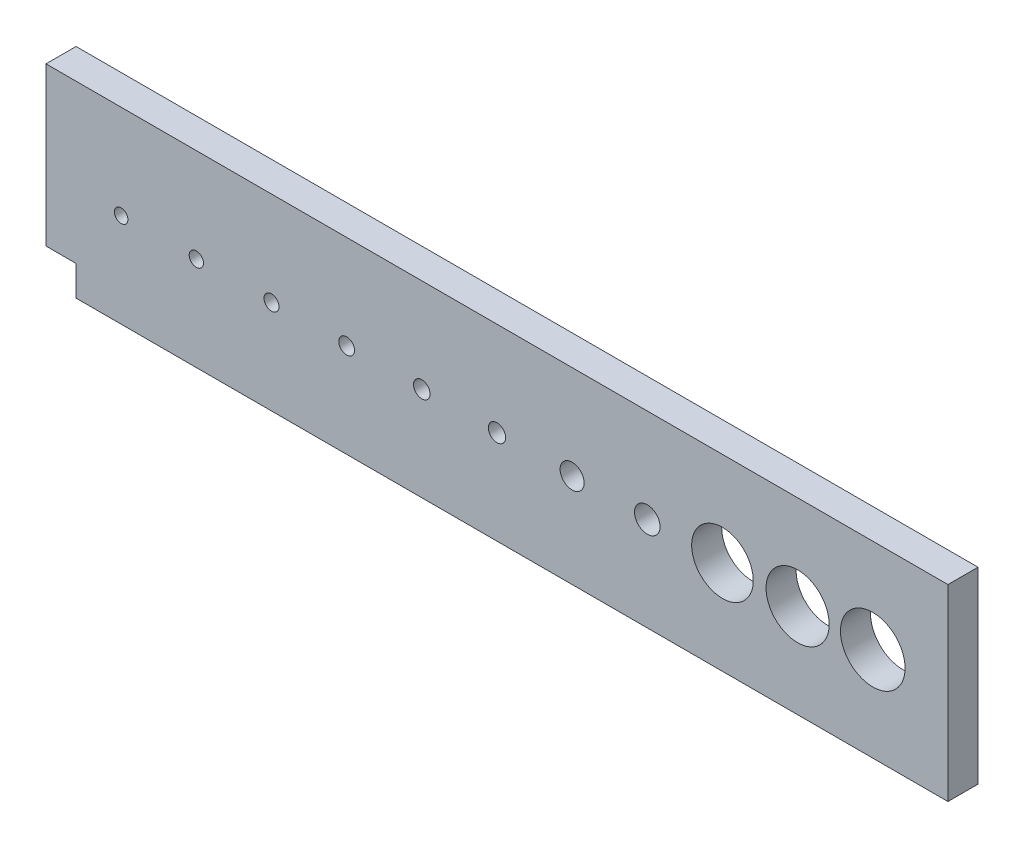
from build123d import *

# Parameters (mm, degrees)
SKETCH1_W               = 120
SKETCH1_H               = 25
COUPON_120X25_DEPTH     = 4
DIAMETER_1P8_START      = -0.1
SKETCH2_R               = 0.9
DIAMETER_1P8_DEPTH      = 4.2
DIAMETER_1P9_START      = -0.1
SKETCH3_R               = 0.95
DIAMETER_1P9_DEPTH      = 4.2
DIAMETER_2_START        = -0.1
SKETCH4_R               = 1
DIAMETER_2_DEPTH        = 4.2
DIAMETER_2P1_START      = -0.1
SKETCH5_R               = 1.05
DIAMETER_2P1_DEPTH      = 4.2
DIAMETER_2P2_START      = -0.1
SKETCH6_R               = 1.1
DIAMETER_2P2_DEPTH      = 4.2
DIAMETER_2P3_START      = -0.1
SKETCH7_R               = 1.15
DIAMETER_2P3_DEPTH      = 4.2
DIAMETER_3P2_START      = -0.1
SKETCH8_R               = 1.6
DIAMETER_3P2_DEPTH      = 4.2
DIAMETER_3P4_START      = -0.1
SKETCH9_R               = 1.7
DIAMETER_3P4_DEPTH      = 4.2
DIAMETER_8P2_START      = -0.1
SKETCH10_R              = 4.1
DIAMETER_8P2_DEPTH      = 4.2
DIAMETER_8P4_START      = -0.1
SKETCH11_R              = 4.2
DIAMETER_8P4_DEPTH      = 4.2
DIAMETER_8P6_START      = -0.1
SKETCH12_R              = 4.3
DIAMETER_8P6_DEPTH      = 4.2
ORIENTATION_NOTCH_START = -0.1
SKETCH13_W              = 4
SKETCH13_H              = 4
ORIENTATION_NOTCH_DEPTH = 4.2


with BuildPart() as part:
    # Sketch1 → Coupon_120x25 (new body)
    with BuildSketch(Plane.XY):
        Rectangle(SKETCH1_W, SKETCH1_H)
    extrude(amount=COUPON_120X25_DEPTH)

    # Sketch2 → Diameter_1p8 (cut)
    with BuildSketch(Plane.XY.offset(DIAMETER_1P8_START)):
        with Locations(Location((-50, 0, 0), (0, 0, 180))):
            Circle(SKETCH2_R)
    extrude(amount=DIAMETER_1P8_DEPTH, mode=Mode.SUBTRACT)

    # Sketch3 → Diameter_1p9 (cut)
    with BuildSketch(Plane.XY.offset(DIAMETER_1P9_START)):
        with Locations(Location((-40, 0, 0), (0, 0, 180))):
            Circle(SKETCH3_R)
    extrude(amount=DIAMETER_1P9_DEPTH, mode=Mode.SUBTRACT)

    # Sketch4 → Diameter_2 (cut)
    with BuildSketch(Plane.XY.offset(DIAMETER_2_START)):
        with Locations(Location((-30, 0, 0), (0, 0, 180))):
            Circle(SKETCH4_R)
    extrude(amount=DIAMETER_2_DEPTH, mode=Mode.SUBTRACT)

    # Sketch5 → Diameter_2p1 (cut)
    with BuildSketch(Plane.XY.offset(DIAMETER_2P1_START)):
        with Locations(Location((-20, 0, 0), (0, 0, 180))):
            Circle(SKETCH5_R)
    extrude(amount=DIAMETER_2P1_DEPTH, mode=Mode.SUBTRACT)

    # Sketch6 → Diameter_2p2 (cut)
    with BuildSketch(Plane.XY.offset(DIAMETER_2P2_START)):
        with Locations(Location((-10, 0, 0), (0, 0, 180))):
            Circle(SKETCH6_R)
    extrude(amount=DIAMETER_2P2_DEPTH, mode=Mode.SUBTRACT)

    # Sketch7 → Diameter_2p3 (cut)
    with BuildSketch(Plane.XY.offset(DIAMETER_2P3_START)):
        with Locations(Location((0, 0, 0), (0, 0, 180))):
            Circle(SKETCH7_R)
    extrude(amount=DIAMETER_2P3_DEPTH, mode=Mode.SUBTRACT)

    # Sketch8 → Diameter_3p2 (cut)
    with BuildSketch(Plane.XY.offset(DIAMETER_3P2_START)):
        with Locations(Location((10, 0, 0), (0, 0, 180))):
            Circle(SKETCH8_R)
    extrude(amount=DIAMETER_3P2_DEPTH, mode=Mode.SUBTRACT)

    # Sketch9 → Diameter_3p4 (cut)
    with BuildSketch(Plane.XY.offset(DIAMETER_3P4_START)):
        with Locations(Location((20, 0, 0), (0, 0, 180))):
            Circle(SKETCH9_R)
    extrude(amount=DIAMETER_3P4_DEPTH, mode=Mode.SUBTRACT)

    # Sketch10 → Diameter_8p2 (cut)
    with BuildSketch(Plane.XY.offset(DIAMETER_8P2_START)):
        with Locations(Location((30, 0, 0), (0, 0, 180))):
            Circle(SKETCH10_R)
    extrude(amount=DIAMETER_8P2_DEPTH, mode=Mode.SUBTRACT)

    # Sketch11 → Diameter_8p4 (cut)
    with BuildSketch(Plane.XY.offset(DIAMETER_8P4_START)):
        with Locations(Location((40, 0, 0), (0, 0, 180))):
            Circle(SKETCH11_R)
    extrude(amount=DIAMETER_8P4_DEPTH, mode=Mode.SUBTRACT)

    # Sketch12 → Diameter_8p6 (cut)
    with BuildSketch(Plane.XY.offset(DIAMETER_8P6_START)):
        with Locations(Location((50, 0, 0), (0, 0, 180))):
            Circle(SKETCH12_R)
    extrude(amount=DIAMETER_8P6_DEPTH, mode=Mode.SUBTRACT)

    # Sketch13 → Orientation_Notch (cut)
    with BuildSketch(Plane.XY.offset(ORIENTATION_NOTCH_START)):
        with Locations((-58, -10.5)):
            Rectangle(SKETCH13_W, SKETCH13_H)
    extrude(amount=ORIENTATION_NOTCH_DEPTH, mode=Mode.SUBTRACT)


solid = part.part
